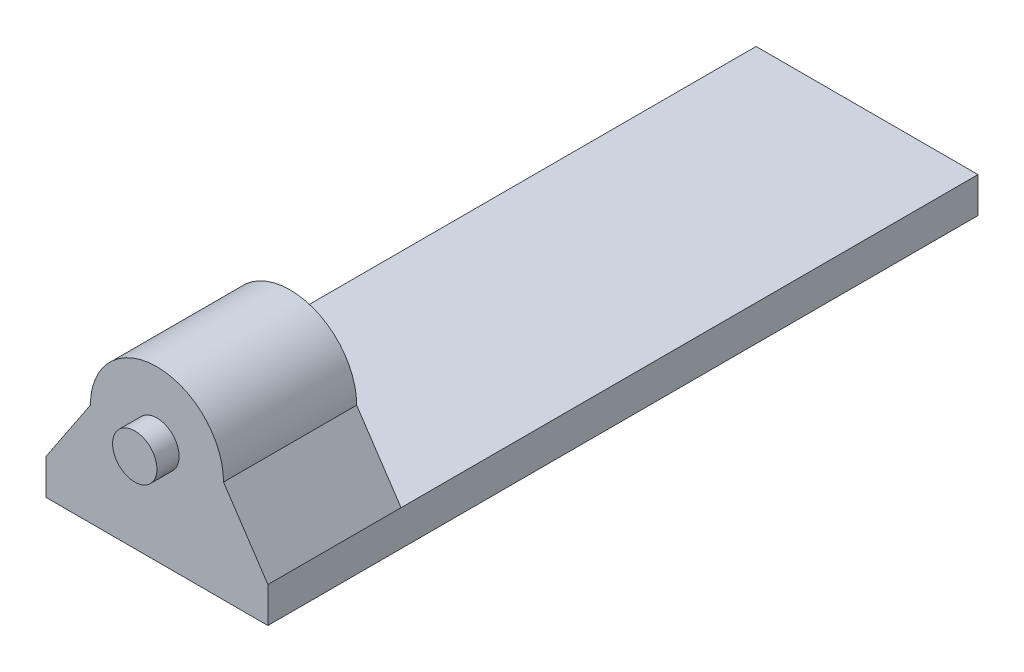
from build123d import *

# Parameters (mm, degrees)
SKETCH_1_W      = 50
SKETCH_1_H      = 8
EXTRUDE_2_DEPTH = 30
SKETCH_5_R      = 5
EXTRUDE_3_DEPTH = 5


with BuildPart() as part:
    # 扫描1: sweep along a path in 草图2
    with BuildLine(Plane(origin=(0, 0, 0), x_dir=(0, 0, -1), z_dir=(1, 0, 0))) as sweep_1_path:
        Line((0, 55.298323556), (-160, 55.298323556))
    # 草图1 → 扫描1 (sweep)
    with BuildSketch(Plane.XY):
        Rectangle(SKETCH_1_W, SKETCH_1_H)
    sweep(path=sweep_1_path.line)

    # 草图4 → 凸台-拉伸2 (add)
    with BuildSketch(Plane.XY.offset(160)):
        with BuildLine():
            Line((15, 19), (25, 4))
            Line((25, 4), (-25, 4))
            Line((-25, 4), (-15, 19))
            ThreePointArc((-15, 19), (0, 34), (15, 19))
        make_face()
    extrude(amount=-EXTRUDE_2_DEPTH)

    # 草图5 → 凸台-拉伸3 (add)
    with BuildSketch(Plane.XY.offset(160)):
        with Locations((0, 19)):
            Circle(SKETCH_5_R)
    extrude(amount=EXTRUDE_3_DEPTH)


solid = part.part
